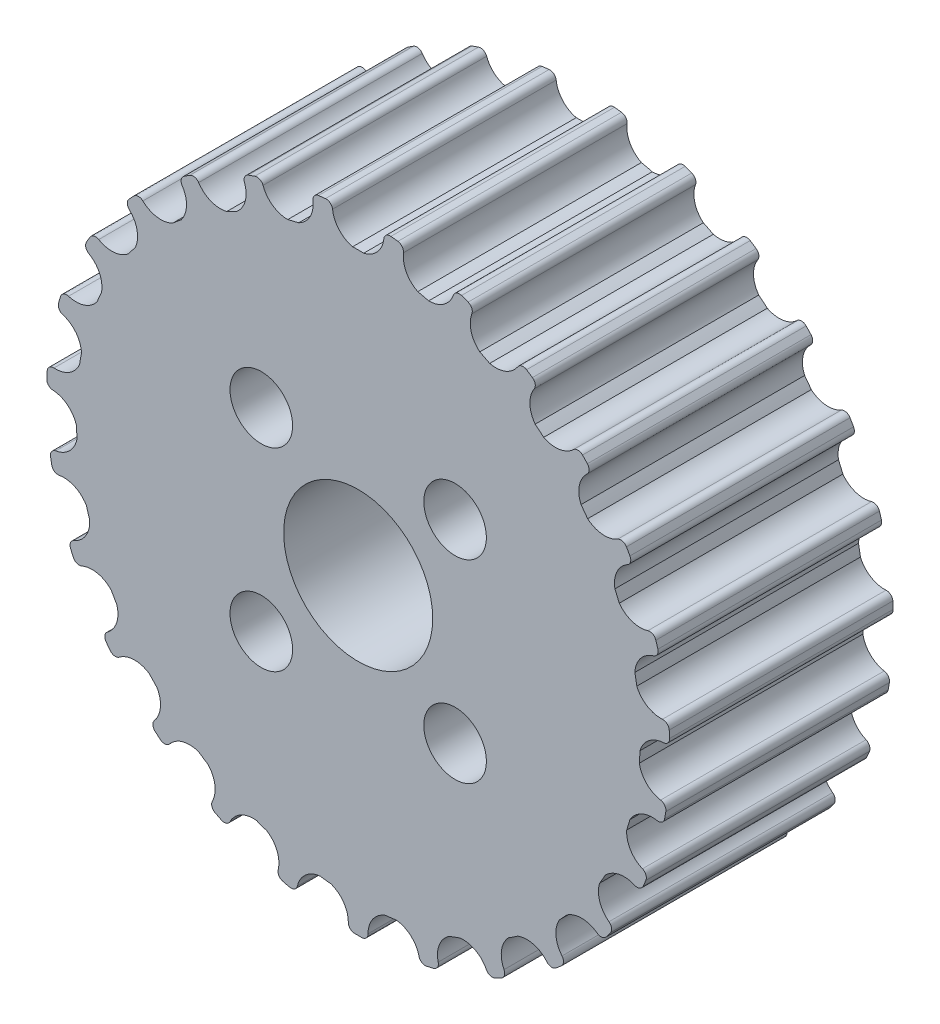
from build123d import *

# Parameters (mm, degrees)
BOSS_EXTRUDE1_DEPTH = 15
SKETCH2_R           = 2.1
SKETCH2_R_2         = 5
CUT_EXTRUDE1_DEPTH  = 34.149111671


with BuildPart() as part:
    # Sketch1 → Boss-Extrude1 (new body)
    with BuildSketch(Plane.XY.offset(7.5)):
        with BuildLine():
            ThreePointArc((-2.192674884, 20.798892855), (-2.427984889, 20.772738301), (-2.662983737, 20.743921634))
            ThreePointArc((-2.662983737, 20.743921634), (-2.947506786, 20.581604741), (-3.035143867, 20.265978568))
            ThreePointArc((-3.035143867, 20.265978568), (-3.233728916, 19.223961151), (-3.998220123, 18.488577228))
            ThreePointArc((-3.998220123, 18.488577228), (-4.362318815, 18.406070375), (-4.724718297, 18.316393998))
            ThreePointArc((-4.724718297, 18.316393998), (-5.737932295, 18.630454047), (-6.38305094, 19.472510015))
            ThreePointArc((-6.38305094, 19.472510015), (-6.603019063, 19.715232416), (-6.930125835, 19.732590379))
            ThreePointArc((-6.930125835, 19.732590379), (-7.153061373, 19.652874603), (-7.375080216, 19.570640229))
            ThreePointArc((-7.375080216, 19.570640229), (-7.614501058, 19.347083077), (-7.626987465, 19.019754147))
            ThreePointArc((-7.626987465, 19.019754147), (-7.579913875, 17.96002758), (-8.154206919, 17.068162221))
            ThreePointArc((-8.154206919, 17.068162221), (-8.489463893, 16.903912414), (-8.821414055, 16.733078203))
            ThreePointArc((-8.821414055, 16.733078203), (-9.87974397, 16.805009495), (-10.701664828, 17.475593137))
            ThreePointArc((-10.701664828, 17.475593137), (-10.97167932, 17.661044784), (-11.293971909, 17.602498848))
            ThreePointArc((-11.293971909, 17.602498848), (-11.492514467, 17.473519347), (-11.689584212, 17.342300543))
            ThreePointArc((-11.689584212, 17.342300543), (-11.870995606, 17.069555157), (-11.807658194, 16.748169857))
            ThreePointArc((-11.807658194, 16.748169857), (-11.517463714, 15.727864274), (-11.870598309, 14.72759817))
            ThreePointArc((-11.870598309, 14.72759817), (-12.158939775, 14.490460159), (-12.442545097, 14.247677831))
            ThreePointArc((-12.442545097, 14.247677831), (-13.48893609, 14.07360253), (-14.443349196, 14.53656251))
            ThreePointArc((-14.443349196, 14.53656251), (-14.748853505, 14.654745656), (-15.048957033, 14.523452047))
            ThreePointArc((-15.048957033, 14.523452047), (-15.212403132, 14.352162141), (-15.373899697, 14.179032945))
            ThreePointArc((-15.373899697, 14.179032945), (-15.487521709, 13.871803101), (-15.351775014, 13.573687395))
            ThreePointArc((-15.351775014, 13.573687395), (-14.834104103, 12.647807734), (-14.947042671, 11.593065491))
            ThreePointArc((-14.947042671, 11.593065491), (-15.172924067, 11.295823447), (-15.392895313, 10.994181459))
            ThreePointArc((-15.392895313, 10.994181459), (-16.370936174, 10.583484011), (-17.40638887, 10.813862035))
            ThreePointArc((-17.40638887, 10.813862035), (-17.73091318, 10.858405396), (-17.992648989, 10.661442188))
            ThreePointArc((-17.992648989, 10.661442188), (-18.112187205, 10.457076159), (-18.22940427, 10.251370012))
            ThreePointArc((-18.22940427, 10.251370012), (-18.269111508, 9.926218548), (-18.06827367, 9.667443932))
            ThreePointArc((-18.06827367, 9.667443932), (-17.351034101, 8.885904605), (-17.217688094, 7.833547649))
            ThreePointArc((-17.217688094, 7.833547649), (-17.368932095, 7.492225968), (-17.513410558, 7.147985919))
            ThreePointArc((-17.513410558, 7.147985919), (-18.370374851, 6.522807129), (-19.431045614, 6.508183458))
            ThreePointArc((-19.431045614, 6.508183458), (-19.757094736, 6.476685692), (-19.96635258, 6.22467122))
            ThreePointArc((-19.96635258, 6.22467122), (-20.035538579, 5.998246494), (-20.10215694, 5.771053068))
            ThreePointArc((-20.10215694, 5.771053068), (-20.065808777, 5.445508984), (-19.810707015, 5.240026065))
            ThreePointArc((-19.810707015, 5.240026065), (-18.932565359, 4.644960059), (-18.560123495, 3.651721227))
            ThreePointArc((-18.560123495, 3.651721227), (-18.628576498, 3.284720649), (-18.689773307, 2.916440608))
            ThreePointArc((-18.689773307, 2.916440608), (-19.379461865, 2.110484027), (-20.40816966, 1.851647027))
            ThreePointArc((-20.40816966, 1.851647027), (-20.718166201, 1.745806185), (-20.863664936, 1.452326616))
            ThreePointArc((-20.863664936, 1.452326616), (-20.878768882, 1.216049808), (-20.891197126, 0.979617159))
            ThreePointArc((-20.891197126, 0.979617159), (-20.7807531, 0.671230622), (-20.485140017, 0.530117036))
            ThreePointArc((-20.485140017, 0.530117036), (-19.493437118, 0.153604514), (-18.901977835, -0.726970433))
            ThreePointArc((-18.901977835, -0.726970433), (-18.88394952, -1.099864811), (-18.858565539, -1.472330771))
            ThreePointArc((-18.858565539, -1.472330771), (-19.343797074, -2.415615816), (-20.285083997, -2.904712175))
            ThreePointArc((-20.285083997, -2.904712175), (-20.562315963, -3.079190186), (-20.636211714, -3.398313292))
            ThreePointArc((-20.636211714, -3.398313292), (-20.59641935, -3.631704437), (-20.553987468, -3.864630165))
            ThreePointArc((-20.553987468, -3.864630165), (-20.375401645, -4.139233957), (-20.055213819, -4.20837074))
            ThreePointArc((-20.055213819, -4.20837074), (-19.003412636, -4.346031891), (-18.224821657, -5.066470928))
            ThreePointArc((-18.224821657, -5.066470928), (-18.121283936, -5.425156274), (-18.010687621, -5.781728417))
            ThreePointArc((-18.010687621, -5.781728417), (-18.265303176, -6.811489185), (-19.068424205, -7.504477591))
            ThreePointArc((-19.068424205, -7.504477591), (-19.297945949, -7.738186616), (-19.296254978, -8.065749251))
            ThreePointArc((-19.296254978, -8.065749251), (-19.20371152, -8.283672557), (-19.108707025, -8.500534276))
            ThreePointArc((-19.108707025, -8.500534276), (-18.871607014, -8.726551362), (-18.544105852, -8.71998416))
            ThreePointArc((-18.544105852, -8.71998416), (-17.48890926, -8.611372591), (-16.565160626, -9.132836663))
            ThreePointArc((-16.565160626, -9.132836663), (-16.381695244, -9.457976159), (-16.191848872, -9.779431588))
            ThreePointArc((-16.191848872, -9.779431588), (-16.202122055, -10.840153409), (-16.823780729, -11.699674678))
            ThreePointArc((-16.823780729, -11.699674678), (-16.993218674, -11.980015403), (-16.916032141, -12.29835858))
            ThreePointArc((-16.916032141, -12.29835858), (-16.775726631, -12.489065745), (-16.633271241, -12.678172384))
            ThreePointArc((-16.633271241, -12.678172384), (-16.350439163, -12.843418125), (-16.033280339, -12.761500976))
            ThreePointArc((-16.033280339, -12.761500976), (-15.03157426, -12.412471966), (-14.012467498, -12.706848811))
            ThreePointArc((-14.012467498, -12.706848811), (-13.758965121, -12.9809141), (-13.500103359, -13.24992307))
            ThreePointArc((-13.500103359, -13.24992307), (-13.265480341, -14.284422156), (-13.672162879, -15.264139275))
            ThreePointArc((-13.672162879, -15.264139275), (-13.772382582, -15.575998458), (-13.623861633, -15.867960214))
            ThreePointArc((-13.623861633, -15.867960214), (-13.443357977, -16.021170165), (-13.261131498, -16.172326937))
            ThreePointArc((-13.261131498, -16.172326937), (-12.947814905, -16.267892892), (-12.658096533, -16.115041972))
            ThreePointArc((-12.658096533, -16.115041972), (-11.7638832, -15.544411764), (-10.70435862, -15.59583145))
            ThreePointArc((-10.70435862, -15.59583145), (-10.394485627, -15.804047602), (-10.08056378, -16.00610777))
            ThreePointArc((-10.08056378, -16.00610777), (-9.613693148, -16.958614008), (-9.783475189, -18.005710173))
            ThreePointArc((-9.783475189, -18.005710173), (-9.80907378, -18.332275405), (-9.597225218, -18.582116006))
            ThreePointArc((-9.597225218, -18.582116006), (-9.386254415, -18.689569156), (-9.174080724, -18.794627158))
            ThreePointArc((-9.174080724, -18.794627158), (-8.847170594, -18.815361342), (-8.600511466, -18.599816884))
            ThreePointArc((-8.600511466, -18.599816884), (-7.861998151, -17.8383483), (-6.819174998, -17.644038779))
            ThreePointArc((-6.819174998, -17.644038779), (-6.469636723, -17.775180808), (-6.117578398, -17.899399058))
            ThreePointArc((-6.117578398, -17.899399058), (-5.443629269, -18.718562589), (-5.367357819, -19.776588574))
            ThreePointArc((-5.367357819, -19.776588574), (-5.316955271, -20.10025464), (-5.053199907, -20.294505115))
            ThreePointArc((-5.053199907, -20.294505115), (-4.823135448, -20.350408635), (-4.592452883, -20.403704165))
            ThreePointArc((-4.592452883, -20.403704165), (-4.269573027, -20.348488792), (-4.0792706, -20.081870853))
            ThreePointArc((-4.0792706, -20.081870853), (-3.536270748, -19.170614863), (-2.566367887, -18.74105141))
            ThreePointArc((-2.566367887, -18.74105141), (-2.196008028, -18.788049415), (-1.824792781, -18.827729108))
            ThreePointArc((-1.824792781, -18.827729108), (-0.980097927, -19.469388616), (-0.6618848, -20.481305967))
            ThreePointArc((-0.6618848, -20.481305967), (-0.538198328, -20.784623945), (-0.236755281, -20.9128122))
            ThreePointArc((-0.236755281, -20.9128122), (0, -20.914152317), (0.236755281, -20.9128122))
            ThreePointArc((0.236755281, -20.9128122), (0.538198328, -20.784623945), (0.6618848, -20.481305967))
            ThreePointArc((0.6618848, -20.481305967), (0.980097927, -19.469388616), (1.824792781, -18.827729108))
            ThreePointArc((1.824792781, -18.827729108), (2.196008028, -18.788049415), (2.566367887, -18.74105141))
            ThreePointArc((2.566367887, -18.74105141), (3.536270748, -19.170614863), (4.0792706, -20.081870853))
            ThreePointArc((4.0792706, -20.081870853), (4.269573027, -20.348488792), (4.592452883, -20.403704165))
            ThreePointArc((4.592452883, -20.403704165), (4.823135448, -20.350408635), (5.053199907, -20.294505115))
            ThreePointArc((5.053199907, -20.294505115), (5.316955271, -20.10025464), (5.367357819, -19.776588574))
            ThreePointArc((5.367357819, -19.776588574), (5.443629269, -18.718562589), (6.117578398, -17.899399058))
            ThreePointArc((6.117578398, -17.899399058), (6.469636723, -17.775180808), (6.819174998, -17.644038779))
            ThreePointArc((6.819174998, -17.644038779), (7.861998151, -17.8383483), (8.600511466, -18.599816884))
            ThreePointArc((8.600511466, -18.599816884), (8.847170594, -18.815361342), (9.174080724, -18.794627158))
            ThreePointArc((9.174080724, -18.794627158), (9.386254415, -18.689569156), (9.597225218, -18.582116006))
            ThreePointArc((9.597225218, -18.582116006), (9.80907378, -18.332275405), (9.783475189, -18.005710173))
            ThreePointArc((9.783475189, -18.005710173), (9.613693148, -16.958614008), (10.08056378, -16.00610777))
            ThreePointArc((10.08056378, -16.00610777), (10.394485627, -15.804047602), (10.70435862, -15.59583145))
            ThreePointArc((10.70435862, -15.59583145), (11.7638832, -15.544411764), (12.658096533, -16.115041972))
            ThreePointArc((12.658096533, -16.115041972), (12.947814905, -16.267892892), (13.261131498, -16.172326937))
            ThreePointArc((13.261131498, -16.172326937), (13.443357977, -16.021170165), (13.623861633, -15.867960214))
            ThreePointArc((13.623861633, -15.867960214), (13.772382582, -15.575998458), (13.672162879, -15.264139275))
            ThreePointArc((13.672162879, -15.264139275), (13.265480341, -14.284422156), (13.500103359, -13.24992307))
            ThreePointArc((13.500103359, -13.24992307), (13.758965121, -12.9809141), (14.012467498, -12.706848811))
            ThreePointArc((14.012467498, -12.706848811), (15.03157426, -12.412471966), (16.033280339, -12.761500976))
            ThreePointArc((16.033280339, -12.761500976), (16.350439163, -12.843418125), (16.633271241, -12.678172384))
            ThreePointArc((16.633271241, -12.678172384), (16.775726631, -12.489065745), (16.916032141, -12.29835858))
            ThreePointArc((16.916032141, -12.29835858), (16.993218674, -11.980015403), (16.823780729, -11.699674678))
            ThreePointArc((16.823780729, -11.699674678), (16.202122055, -10.840153409), (16.191848872, -9.779431588))
            ThreePointArc((16.191848872, -9.779431588), (16.381695244, -9.457976159), (16.565160626, -9.132836663))
            ThreePointArc((16.565160626, -9.132836663), (17.48890926, -8.611372591), (18.544105852, -8.71998416))
            ThreePointArc((18.544105852, -8.71998416), (18.871607014, -8.726551362), (19.108707025, -8.500534276))
            ThreePointArc((19.108707025, -8.500534276), (19.20371152, -8.283672557), (19.296254978, -8.065749251))
            ThreePointArc((19.296254978, -8.065749251), (19.297945949, -7.738186616), (19.068424205, -7.504477591))
            ThreePointArc((19.068424205, -7.504477591), (18.265303176, -6.811489185), (18.010687621, -5.781728417))
            ThreePointArc((18.010687621, -5.781728417), (18.121283936, -5.425156274), (18.224821657, -5.066470928))
            ThreePointArc((18.224821657, -5.066470928), (19.003412636, -4.346031891), (20.055213819, -4.20837074))
            ThreePointArc((20.055213819, -4.20837074), (20.375401645, -4.139233957), (20.553987468, -3.864630165))
            ThreePointArc((20.553987468, -3.864630165), (20.59641935, -3.631704437), (20.636211714, -3.398313292))
            ThreePointArc((20.636211714, -3.398313292), (20.562315963, -3.079190186), (20.285083997, -2.904712175))
            ThreePointArc((20.285083997, -2.904712175), (19.343797074, -2.415615816), (18.858565539, -1.472330771))
            ThreePointArc((18.858565539, -1.472330771), (18.88394952, -1.099864811), (18.901977835, -0.726970433))
            ThreePointArc((18.901977835, -0.726970433), (19.493437118, 0.153604514), (20.485140017, 0.530117036))
            ThreePointArc((20.485140017, 0.530117036), (20.7807531, 0.671230622), (20.891197126, 0.979617159))
            ThreePointArc((20.891197126, 0.979617159), (20.878768882, 1.216049808), (20.863664936, 1.452326616))
            ThreePointArc((20.863664936, 1.452326616), (20.718166201, 1.745806185), (20.40816966, 1.851647027))
            ThreePointArc((20.40816966, 1.851647027), (19.379461865, 2.110484027), (18.689773307, 2.916440608))
            ThreePointArc((18.689773307, 2.916440608), (18.628576498, 3.284720649), (18.560123495, 3.651721227))
            ThreePointArc((18.560123495, 3.651721227), (18.932565359, 4.644960059), (19.810707015, 5.240026065))
            ThreePointArc((19.810707015, 5.240026065), (20.065808777, 5.445508984), (20.10215694, 5.771053068))
            ThreePointArc((20.10215694, 5.771053068), (20.035538579, 5.998246494), (19.96635258, 6.22467122))
            ThreePointArc((19.96635258, 6.22467122), (19.757094736, 6.476685692), (19.431045614, 6.508183458))
            ThreePointArc((19.431045614, 6.508183458), (18.370374851, 6.522807129), (17.513410558, 7.147985919))
            ThreePointArc((17.513410558, 7.147985919), (17.368932095, 7.492225968), (17.217688094, 7.833547649))
            ThreePointArc((17.217688094, 7.833547649), (17.351034101, 8.885904605), (18.06827367, 9.667443932))
            ThreePointArc((18.06827367, 9.667443932), (18.269111508, 9.926218548), (18.22940427, 10.251370012))
            ThreePointArc((18.22940427, 10.251370012), (18.112187205, 10.457076159), (17.992648989, 10.661442188))
            ThreePointArc((17.992648989, 10.661442188), (17.73091318, 10.858405396), (17.40638887, 10.813862035))
            ThreePointArc((17.40638887, 10.813862035), (16.370936174, 10.583484011), (15.392895313, 10.994181459))
            ThreePointArc((15.392895313, 10.994181459), (15.172924067, 11.295823447), (14.947042671, 11.593065491))
            ThreePointArc((14.947042671, 11.593065491), (14.834104103, 12.647807734), (15.351775014, 13.573687395))
            ThreePointArc((15.351775014, 13.573687395), (15.487521709, 13.871803101), (15.373899697, 14.179032945))
            ThreePointArc((15.373899697, 14.179032945), (15.212403132, 14.352162141), (15.048957033, 14.523452047))
            ThreePointArc((15.048957033, 14.523452047), (14.748853505, 14.654745656), (14.443349196, 14.53656251))
            ThreePointArc((14.443349196, 14.53656251), (13.48893609, 14.07360253), (12.442545097, 14.247677831))
            ThreePointArc((12.442545097, 14.247677831), (12.158939775, 14.490460159), (11.870598309, 14.72759817))
            ThreePointArc((11.870598309, 14.72759817), (11.517463714, 15.727864274), (11.807658194, 16.748169857))
            ThreePointArc((11.807658194, 16.748169857), (11.870995606, 17.069555157), (11.689584212, 17.342300543))
            ThreePointArc((11.689584212, 17.342300543), (11.492514467, 17.473519347), (11.293971909, 17.602498848))
            ThreePointArc((11.293971909, 17.602498848), (10.97167932, 17.661044784), (10.701664828, 17.475593137))
            ThreePointArc((10.701664828, 17.475593137), (9.87974397, 16.805009495), (8.821414055, 16.733078203))
            ThreePointArc((8.821414055, 16.733078203), (8.489463893, 16.903912414), (8.154206919, 17.068162221))
            ThreePointArc((8.154206919, 17.068162221), (7.579913875, 17.96002758), (7.626987465, 19.019754147))
            ThreePointArc((7.626987465, 19.019754147), (7.614501058, 19.347083077), (7.375080216, 19.570640229))
            ThreePointArc((7.375080216, 19.570640229), (7.153061373, 19.652874603), (6.930125835, 19.732590379))
            ThreePointArc((6.930125835, 19.732590379), (6.603019063, 19.715232416), (6.38305094, 19.472510015))
            ThreePointArc((6.38305094, 19.472510015), (5.737932295, 18.630454047), (4.724718297, 18.316393998))
            ThreePointArc((4.724718297, 18.316393998), (4.362318815, 18.406070375), (3.998220123, 18.488577228))
            ThreePointArc((3.998220123, 18.488577228), (3.233728916, 19.223961151), (3.035143867, 20.265978568))
            ThreePointArc((3.035143867, 20.265978568), (2.947506786, 20.581604741), (2.662983737, 20.743921634))
            ThreePointArc((2.662983737, 20.743921634), (2.427984889, 20.772738301), (2.192674884, 20.798892855))
            ThreePointArc((2.192674884, 20.798892855), (1.878388339, 20.706566765), (1.720325123, 20.419658838))
            ThreePointArc((1.720325123, 20.419658838), (1.286787205, 19.451525999), (0.373311754, 18.912268251))
            ThreePointArc((0.373311754, 18.912268251), (0, 18.915952317), (-0.373311754, 18.912268251))
            ThreePointArc((-0.373311754, 18.912268251), (-1.286787205, 19.451525999), (-1.720325123, 20.419658838))
            ThreePointArc((-1.720325123, 20.419658838), (-1.878388339, 20.706566765), (-2.192674884, 20.798892855))
        make_face()
    extrude(amount=-BOSS_EXTRUDE1_DEPTH)

    # Sketch2 → Cut-Extrude1 (cut, through all)
    with BuildSketch(Plane.XY.offset(7.5)):
        with Locations((-6.5, 6.5)):
            Circle(SKETCH2_R)
        with Locations((6.5, 6.5)):
            Circle(SKETCH2_R)
        with Locations((6.5, -6.5)):
            Circle(SKETCH2_R)
        with Locations((-6.5, -6.5)):
            Circle(SKETCH2_R)
        Circle(SKETCH2_R_2)
    extrude(amount=-CUT_EXTRUDE1_DEPTH, mode=Mode.SUBTRACT)


solid = part.part
